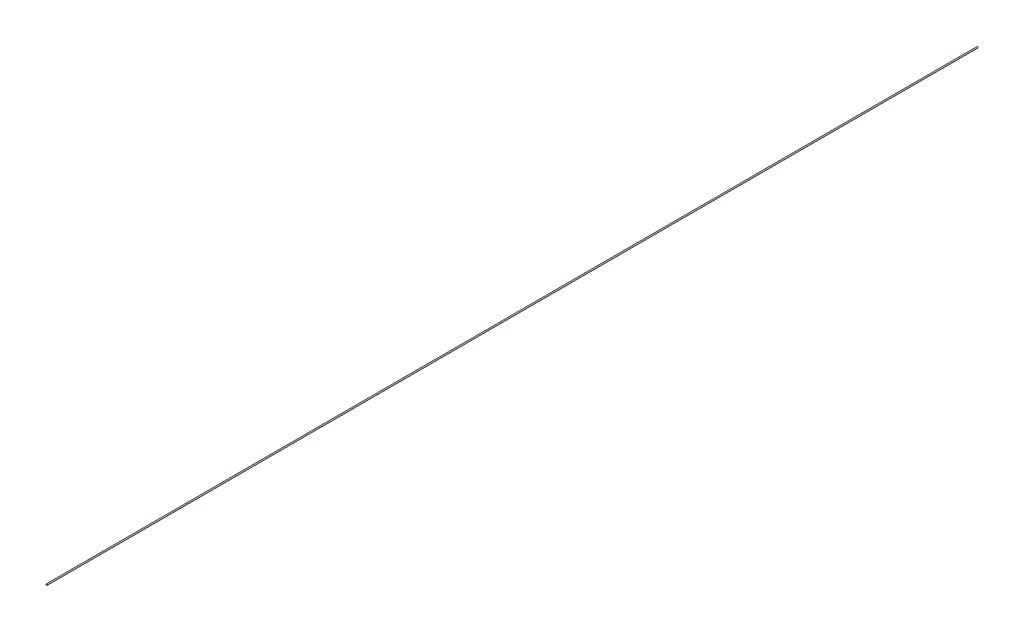
from build123d import *

# Parameters (mm, degrees)
SKETCH1_R           = 88.9
SKETCH1_R_2         = 50.8
BOSS_EXTRUDE1_DEPTH = 130356.864


with BuildPart() as part:
    # Sketch1 → Boss-Extrude1 (new body)
    with BuildSketch(Plane.XY):
        Circle(SKETCH1_R)
        Circle(SKETCH1_R_2, mode=Mode.SUBTRACT)
    extrude(amount=BOSS_EXTRUDE1_DEPTH)


solid = part.part
